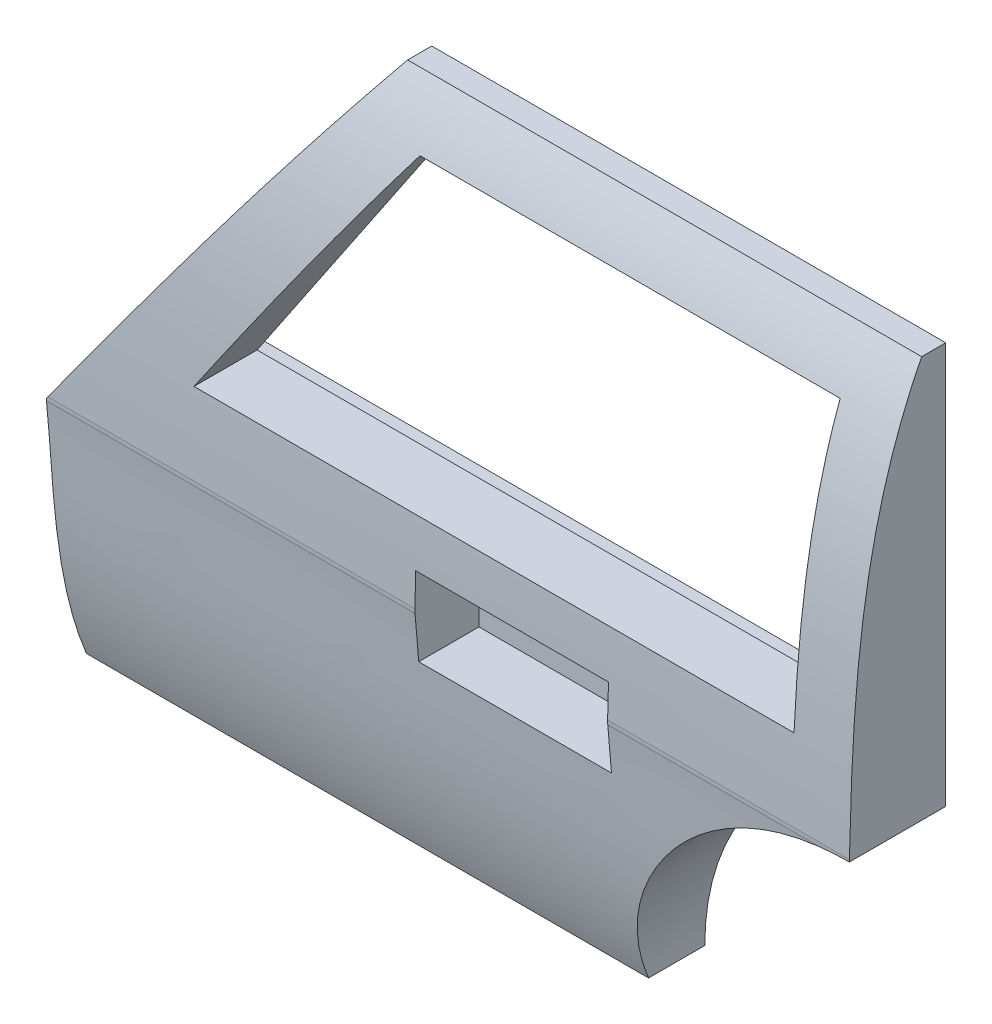
from build123d import *

# Parameters (mm, degrees)
BOSS_EXTRUDE1_DEPTH = 76.2
CUT_EXTRUDE1_DEPTH  = 1629.177643871
CUT_EXTRUDE2_DEPTH  = 1629.177644016
FILLET1_R           = 50.8
CUT_EXTRUDE3_DEPTH  = 48.26
CUT_EXTRUDE4_DEPTH  = 1506.588524386
SKETCH5_W           = 101.6
SKETCH5_H           = 127
CUT_EXTRUDE5_DEPTH  = 25.4
LPATTERN1_COUNT     = 2
LPATTERN1_PITCH     = 254
SKETCH6_W           = 304.8
SKETCH6_H           = 127
CUT_EXTRUDE6_DEPTH  = 153.67


with BuildPart() as part:
    # Sketch1 → Boss-Extrude1 (new, symmetric)
    with BuildSketch(Plane.XY):
        with BuildLine():
            Line((0, 0), (0, 381))
            Line((0, 381), (457.2, 1016))
            Line((457.2, 1016), (1270, 1016))
            Line((1270, 1016), (1270, 381))
            ThreePointArc((1270, 381), (1000.592316368, 269.407683632), (889, 0))
            Line((889, 0), (0, 0))
        make_face()
    extrude(amount=BOSS_EXTRUDE1_DEPTH, both=True)

    # Sketch2 → Cut-Extrude1 (cut, through all)
    with BuildSketch(Plane(origin=(1270, 0, 0), x_dir=(0, 0, -1), z_dir=(1, 0, 0))):
        with BuildLine():
            Line((-76.2, 1016), (38.1, 1016))
            add(Edge.make_bspline(
                [(38.1, 1016), (-59.769782928, 824.490487528), (-71.194008123, 596.511314057), (-76.2, 381)],
                knots=[0, 0, 0, 0, 1, 1, 1, 1], degree=3))
            Line((-76.2, 381), (-76.2, 1016))
        make_face()
    extrude(amount=-CUT_EXTRUDE1_DEPTH, mode=Mode.SUBTRACT)

    # Sketch3 → Cut-Extrude2 (cut, through all)
    with BuildSketch(Plane.ZY):
        with BuildLine():
            Line((76.2, 0), (12.7, 0))
            add(Edge.make_bspline(
                [(76.2, 381), (64.47102467, 274.36986488), (67.170280271, 132.109019993), (12.7, 0)],
                knots=[0, 0, 0, 0, 1, 1, 1, 1], degree=3))
            Line((76.2, 381), (76.2, 0))
        make_face()
    extrude(amount=-CUT_EXTRUDE2_DEPTH, mode=Mode.SUBTRACT)

    # Fillet1
    fillet1_edges = [part.edges().sort_by_distance(p)[0] for p in [
        (635, 381, 76.2),
    ]]
    fillet(fillet1_edges, radius=FILLET1_R)

    # Sketch4 → Cut-Extrude3 (cut)
    with BuildSketch(Plane(origin=(0, 0, -76.2), x_dir=(-1, 0, 0), z_dir=(0, 0, -1))):
        Polygon((-1208.685916752, 962.035600553), (-1208.685916752, 479.435600553), (-171.968106524, 479.435600553), (-497.485916752, 962.035600553), align=None)
    extrude(amount=-CUT_EXTRUDE3_DEPTH, mode=Mode.SUBTRACT)

    # 3DSketch1 → Cut-Extrude4 (cut, through all)
    with BuildSketch(Plane(origin=(1178.205916752, 931.555600553, -27.94), x_dir=(-0.9138470118423624, -0.4060586644153593, 0), z_dir=(0, 0, 1))):
        Polygon((0, 0), (171.210575264, 385.314454073), (1038.372129325, 0), (607.263673126, -269.831462884), align=None)
    extrude(amount=CUT_EXTRUDE4_DEPTH, mode=Mode.SUBTRACT)

    # Sketch5 → Cut-Extrude5 (cut)
    with BuildSketch(Plane(origin=(-180.663856691, 130.077976818, 0), x_dir=(0, 0, 1), z_dir=(-0.8115343414514944, 0.5843047258450759, 0))):
        with Locations((-25.4, 448.894584093)):
            Rectangle(SKETCH5_W, SKETCH5_H)
    cut_extrude5 = extrude(amount=-CUT_EXTRUDE5_DEPTH, mode=Mode.SUBTRACT)

    # LPattern1: Cut-Extrude5 ×2
    with Locations(*[Vector(0.5843047258450755, 0.8115343414514946, 0) * (i * LPATTERN1_PITCH) for i in range(1, LPATTERN1_COUNT)]):
        add(cut_extrude5, mode=Mode.SUBTRACT)

    # Sketch6 → Cut-Extrude6 (cut)
    with BuildSketch(Plane.XY.offset(128.348177056)):
        with Locations((735.261288267, 372.214025497)):
            Rectangle(SKETCH6_W, SKETCH6_H)
    extrude(amount=-CUT_EXTRUDE6_DEPTH, mode=Mode.SUBTRACT)


solid = part.part
